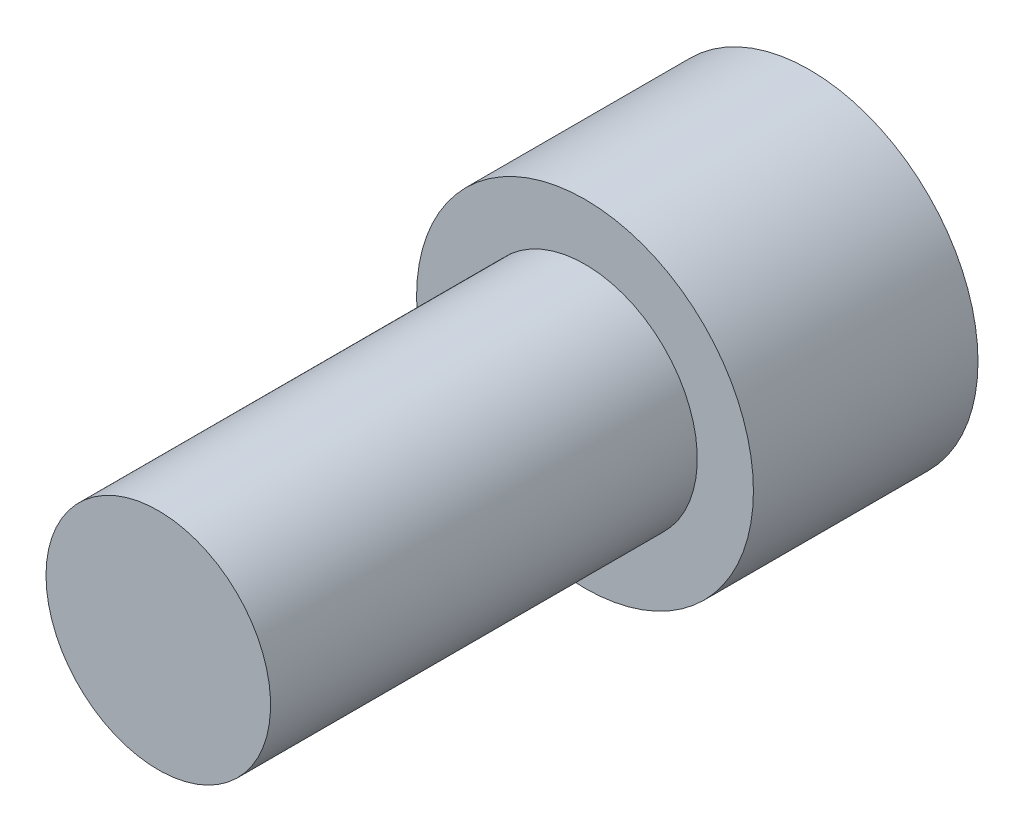
from build123d import *

# Parameters (mm, degrees)
SKETCH1_R           = 7.5
BOSS_EXTRUDE1_DEPTH = 250
SKETCH2_R           = 5
CUT_EXTRUDE1_DEPTH  = 10
SKETCH3_R           = 9.435011435
SKETCH3_R_2         = 5
CUT_EXTRUDE2_DEPTH  = 19
SKETCH5_R           = 25.765699078
CUT_EXTRUDE3_DEPTH  = 221
SKETCH6_R           = 5.5
BOSS_EXTRUDE2_DEPTH = 10


with BuildPart() as part:
    # Sketch1 → Boss-Extrude1 (new body)
    with BuildSketch(Plane.XY):
        Circle(SKETCH1_R)
    extrude(amount=BOSS_EXTRUDE1_DEPTH)

    # Sketch2 → Cut-Extrude1 (cut)
    with BuildSketch(Plane.XY):
        Circle(SKETCH2_R)
    extrude(amount=CUT_EXTRUDE1_DEPTH, mode=Mode.SUBTRACT)

    # Sketch3 → Cut-Extrude2 (cut)
    with BuildSketch(Plane(origin=(0, 0, 10), x_dir=(-1, 0, 0), z_dir=(0, 0, -1))):
        Circle(SKETCH3_R)
        Circle(SKETCH3_R_2, mode=Mode.SUBTRACT)
    extrude(amount=-CUT_EXTRUDE2_DEPTH, mode=Mode.SUBTRACT)


with BuildPart() as cut_extrude2_piece_1:
    # of the separate pieces the step leaves, piece 1, a body of its own (cut_extrude2_pieces)
    add(part.part.solids().sort_by_distance((7.5, 0, 29))[0])

    # Sketch5 → Cut-Extrude3 (cut)
    with BuildSketch(Plane(origin=(0, 0, 29), x_dir=(-1, 0, 0), z_dir=(0, 0, -1))):
        Circle(SKETCH5_R)
    extrude(amount=-CUT_EXTRUDE3_DEPTH, mode=Mode.SUBTRACT)



with BuildPart() as cut_extrude2_piece_2:
    # of the separate pieces the step leaves, piece 2, a body of its own (cut_extrude2_pieces)
    add(part.part.solids().sort_by_distance((7.5, 0, 0))[0])


with BuildPart() as cut_extrude2_piece_1_1:
    add(cut_extrude2_piece_1.part)

    add(cut_extrude2_piece_2.part)  # Boss-Extrude2 merges Cut-Extrude2 piece 2
    # Sketch6 → Boss-Extrude2 (add)
    with BuildSketch(Plane(origin=(0, 0, 10), x_dir=(-1, 0, 0), z_dir=(0, 0, -1))):
        Circle(SKETCH6_R)
    extrude(amount=BOSS_EXTRUDE2_DEPTH)


solid = cut_extrude2_piece_1_1.part
